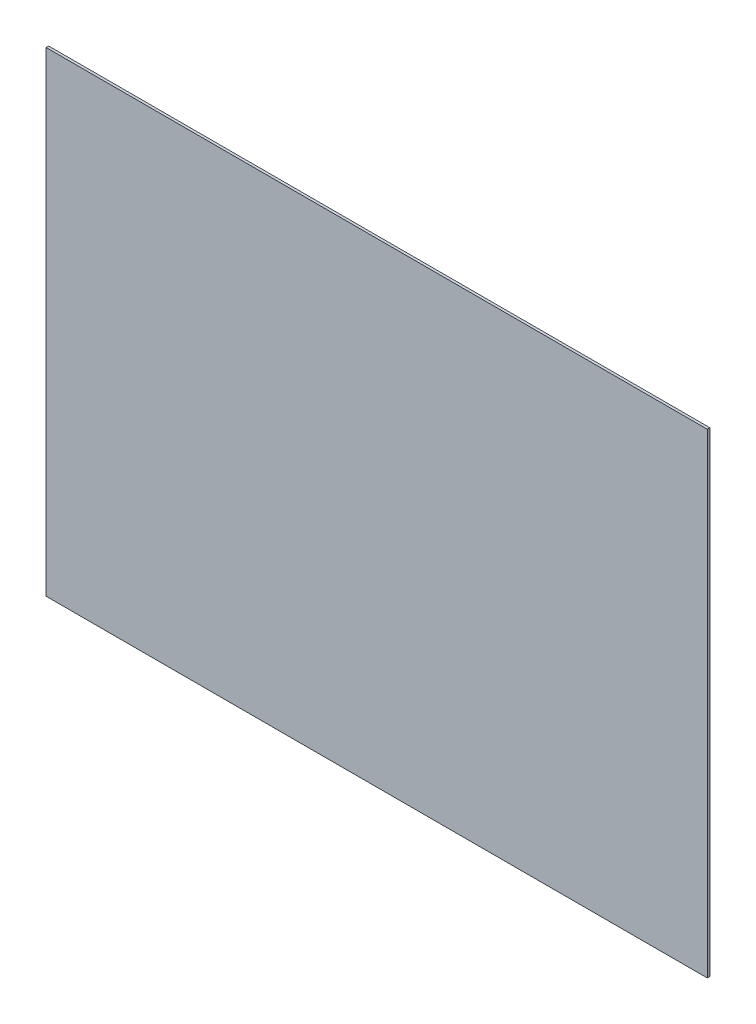
from build123d import *

# Parameters (mm, degrees)
SKETCH1_W           = 812.8
SKETCH1_H           = 584.2
BOSS_EXTRUDE1_DEPTH = 3.175


with BuildPart() as part:
    # Sketch1 → Boss-Extrude1 (new body)
    with BuildSketch(Plane.XY):
        with Locations((406.4, 292.1)):
            Rectangle(SKETCH1_W, SKETCH1_H)
    extrude(amount=BOSS_EXTRUDE1_DEPTH)


solid = part.part
